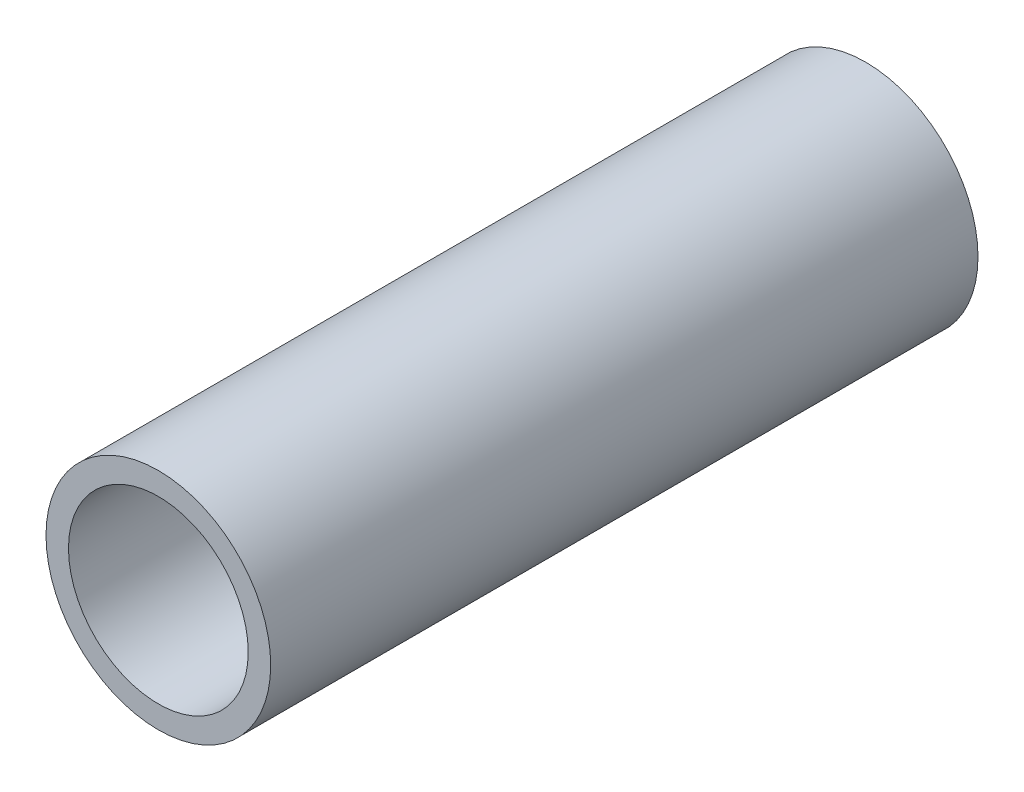
from build123d import *

# Parameters (mm, degrees)
SKETCH1_R      = 0.635
SKETCH1_R_2    = 0.508
EXTRUDE1_DEPTH = 3.99796


with BuildPart() as part:
    # Sketch1 → Extrude1 (new body)
    with BuildSketch(Plane.XY):
        with Locations(Location((0, 0, 0), (0, 0, 180))):
            Circle(SKETCH1_R)
        with Locations(Location((0, 0, 0), (0, 0, 180))):
            Circle(SKETCH1_R_2, mode=Mode.SUBTRACT)
    extrude(amount=EXTRUDE1_DEPTH)


solid = part.part
